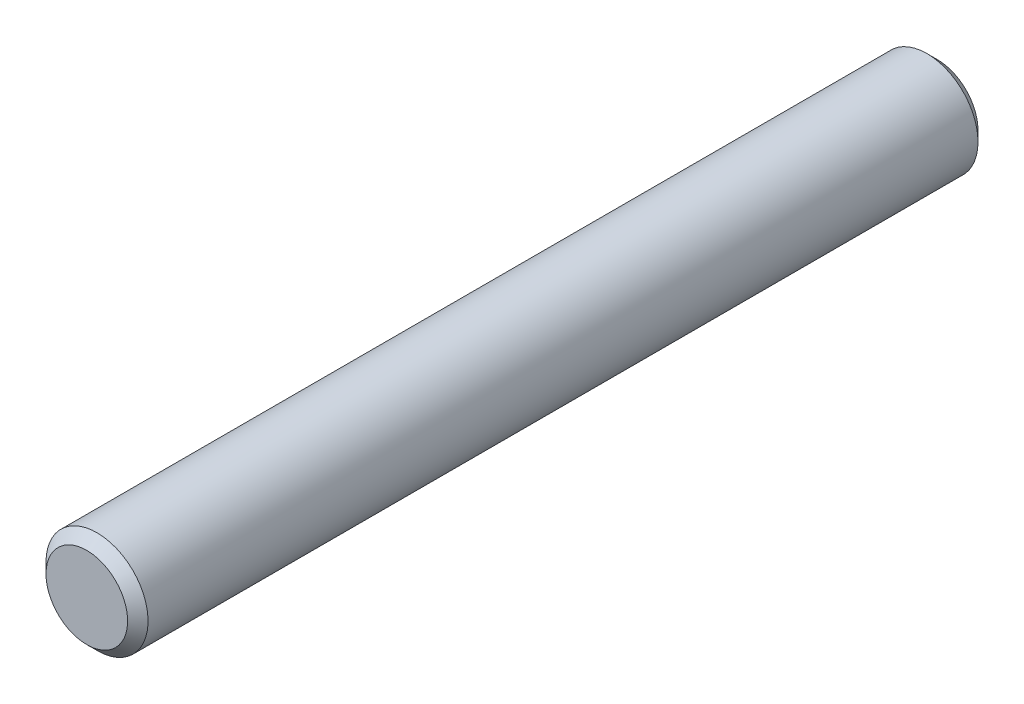
from build123d import *

# Parameters (mm, degrees)
SKETCH3_R           = 4.7625
BOSS_EXTRUDE1_DEPTH = 39.6875
CHAMFER1_SIZE       = 0.9525


with BuildPart() as part:
    # Sketch3 → Boss-Extrude1 (new, symmetric)
    with BuildSketch(Plane.XY):
        with Locations(Location((0, 0, 0), (0, 0, 180))):
            Circle(SKETCH3_R)
    extrude(amount=BOSS_EXTRUDE1_DEPTH, both=True)

    # Chamfer1
    chamfer1_edges = [part.edges().sort_by_distance(p)[0] for p in [
        (4.7625, 0, -39.6875),
        (4.7625, 0, 39.6875),
    ]]
    chamfer(chamfer1_edges, length=CHAMFER1_SIZE)


solid = part.part
